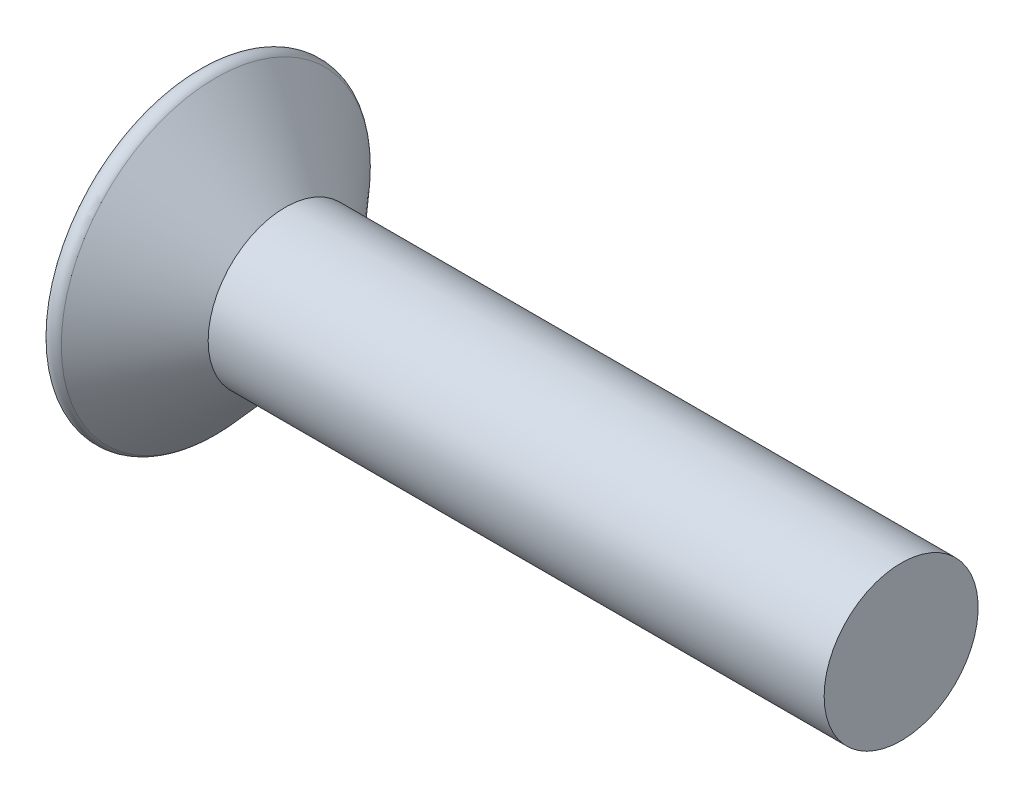
from build123d import *

# Parameters (mm, degrees)
CONG_1_R                = 0.2
ENL_V_MAT_EXTRU_1_DEPTH = 0.2


with BuildPart() as part:
    # Esquisse1 → Révolution1 (revolve)
    with BuildSketch(Plane.XY, mode=Mode.PRIVATE) as r_volution1_sk:
        Polygon((0, 0), (0, 3.4), (1.7, 1.5), (13.7, 1.5), (13.7, 0), align=None)
    revolve(r_volution1_sk.sketch.rotate(Axis((0, 0, 0), (1, 0, 0)), 90), axis=Axis((0, 0, 0), (1, 0, 0)))

    # Congé1
    cong_1_edges = [part.edges().sort_by_distance(p)[0] for p in [
        (0, 0, -3.4),
    ]]
    fillet(cong_1_edges, radius=CONG_1_R)

    # Esquisse2 → Enlèv. mat.-Extru.1 (cut)
    with BuildSketch(Plane.ZY):
        Polygon((0.5, -0.866025404), (1, 0), (0.5, 0.866025404), (-0.5, 0.866025404), (-1, 0), (-0.5, -0.866025404), align=None)
    extrude(amount=-ENL_V_MAT_EXTRU_1_DEPTH, mode=Mode.SUBTRACT)


solid = part.part
